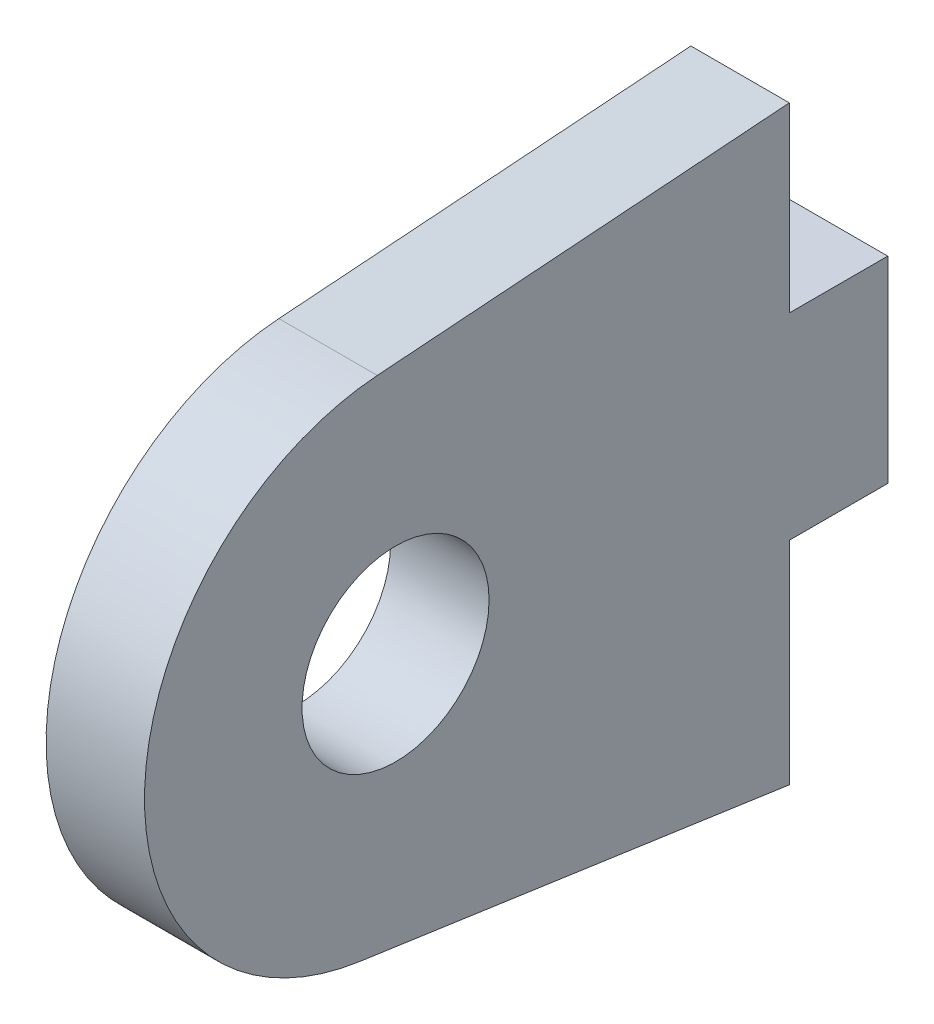
from build123d import *

# Parameters (mm, degrees)
SKETCH1_R           = 4.75
BOSS_EXTRUDE1_DEPTH = 2.5


with BuildPart() as part:
    # Sketch1 → Boss-Extrude1 (new, symmetric)
    with BuildSketch(Plane.YZ):
        with BuildLine():
            Line((-15.757717512, 0), (-5, 0))
            Line((-5, 0), (-5, -5))
            Line((-5, -5), (5, -5))
            Line((5, -5), (5, 0))
            Line((5, 0), (14.242282488, 0))
            Line((14.242282488, 0), (12.716235334, 20.927285791))
            ThreePointArc((12.716235334, 20.927285791), (0.446501859, 32.742179409), (-12.620138577, 21.815103933))
            Line((-12.620138577, 21.815103933), (-15.757717512, 0))
        make_face()
        with Locations(Location((0, 20, 0), (0, 0, 270))):
            Circle(SKETCH1_R, mode=Mode.SUBTRACT)
    extrude(amount=BOSS_EXTRUDE1_DEPTH, both=True)


solid = part.part
